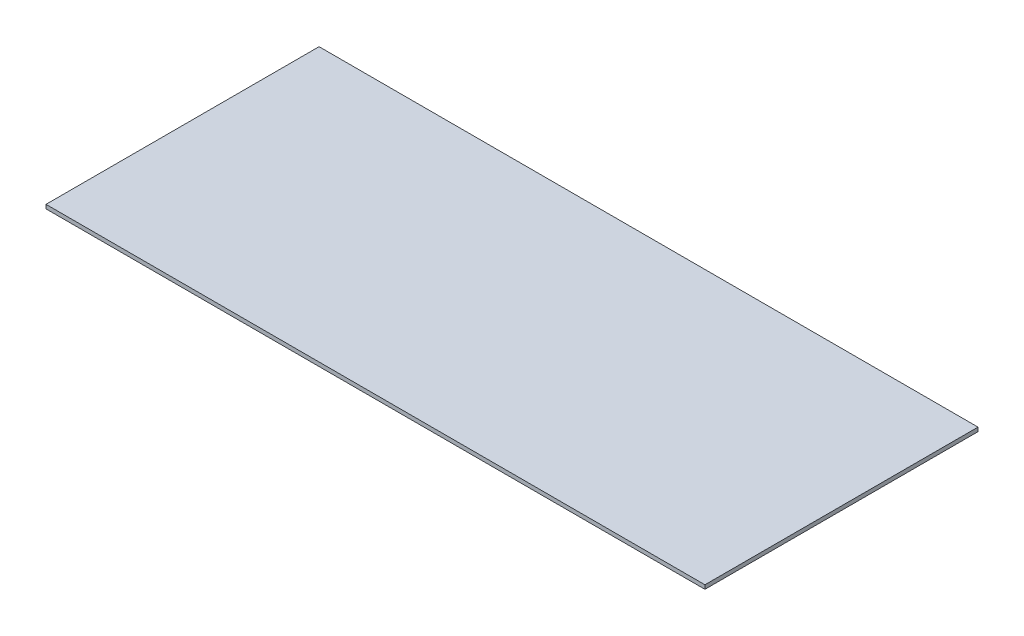
from build123d import *

# Parameters (mm, degrees)
SKETCH1_W           = 2114.55
SKETCH1_H           = 876.3
BOSS_EXTRUDE1_DEPTH = 12.7


with BuildPart() as part:
    # Sketch1 → Boss-Extrude1 (new body)
    with BuildSketch(Plane(origin=(0, 0, 0), x_dir=(1, 0, 0), z_dir=(0, 1, 0))):
        with Locations((1057.275, 438.15)):
            Rectangle(SKETCH1_W, SKETCH1_H)
    extrude(amount=BOSS_EXTRUDE1_DEPTH)


solid = part.part
